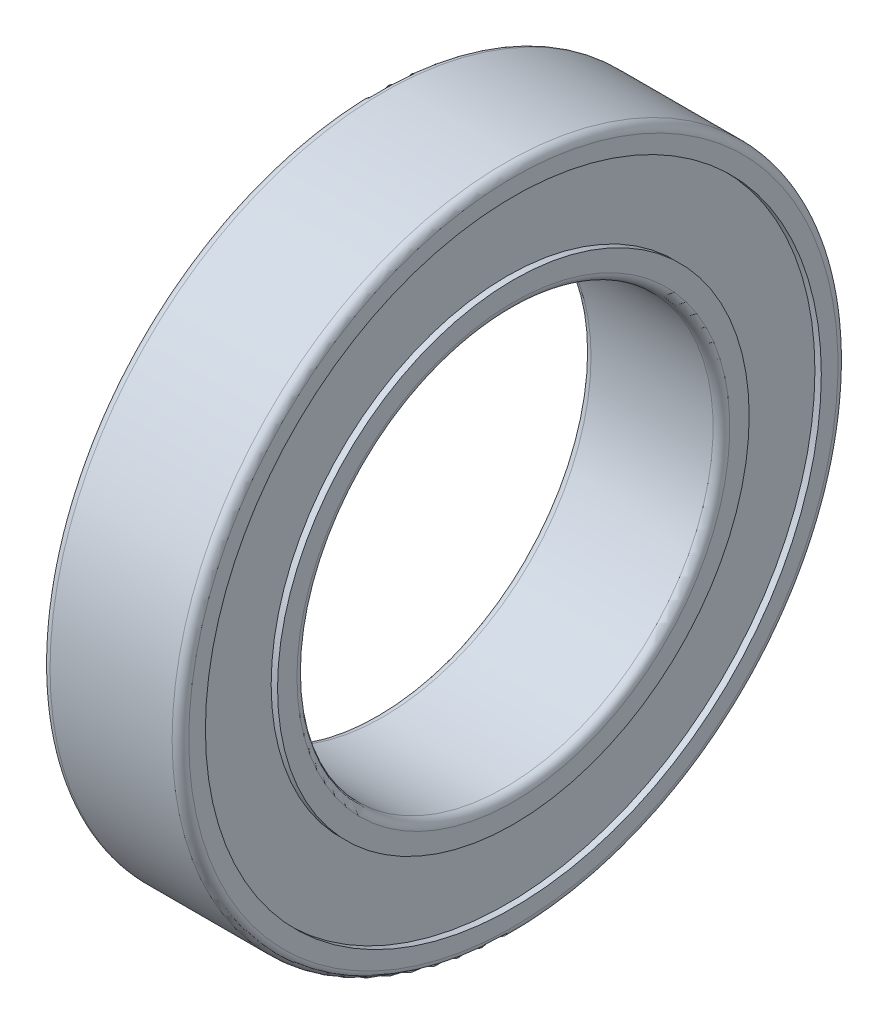
from build123d import *

# Parameters (mm, degrees)
FILLET1_R = 0.3
FILLET2_R = 0.3


with BuildPart() as part:
    # Sketch1 → Revolve1 (revolve)
    with BuildSketch(Plane.XY, mode=Mode.PRIVATE) as revolve1_sk:
        Polygon((0, 7.5), (5, 7.5), (5, 8.5), (4.77, 8.5), (4.77, 11.1), (5, 11.1), (5, 12), (0, 12), (0, 11.1), (0.23, 11.1), (0.23, 8.5), (0, 8.5), align=None)
    revolve(revolve1_sk.sketch.rotate(Axis((0, 0, 0), (1, 0, 0)), 90), axis=Axis((0, 0, 0), (1, 0, 0)))

    # Fillet1
    fillet1_edges = [part.edges().sort_by_distance(p)[0] for p in [
        (0, 0, -12),
        (5, 0, -12),
    ]]
    fillet(fillet1_edges, radius=FILLET1_R)

    # Fillet2
    fillet2_edges = [part.edges().sort_by_distance(p)[0] for p in [
        (5, 0, -7.5),
        (0, 0, -7.5),
    ]]
    fillet(fillet2_edges, radius=FILLET2_R)


solid = part.part
